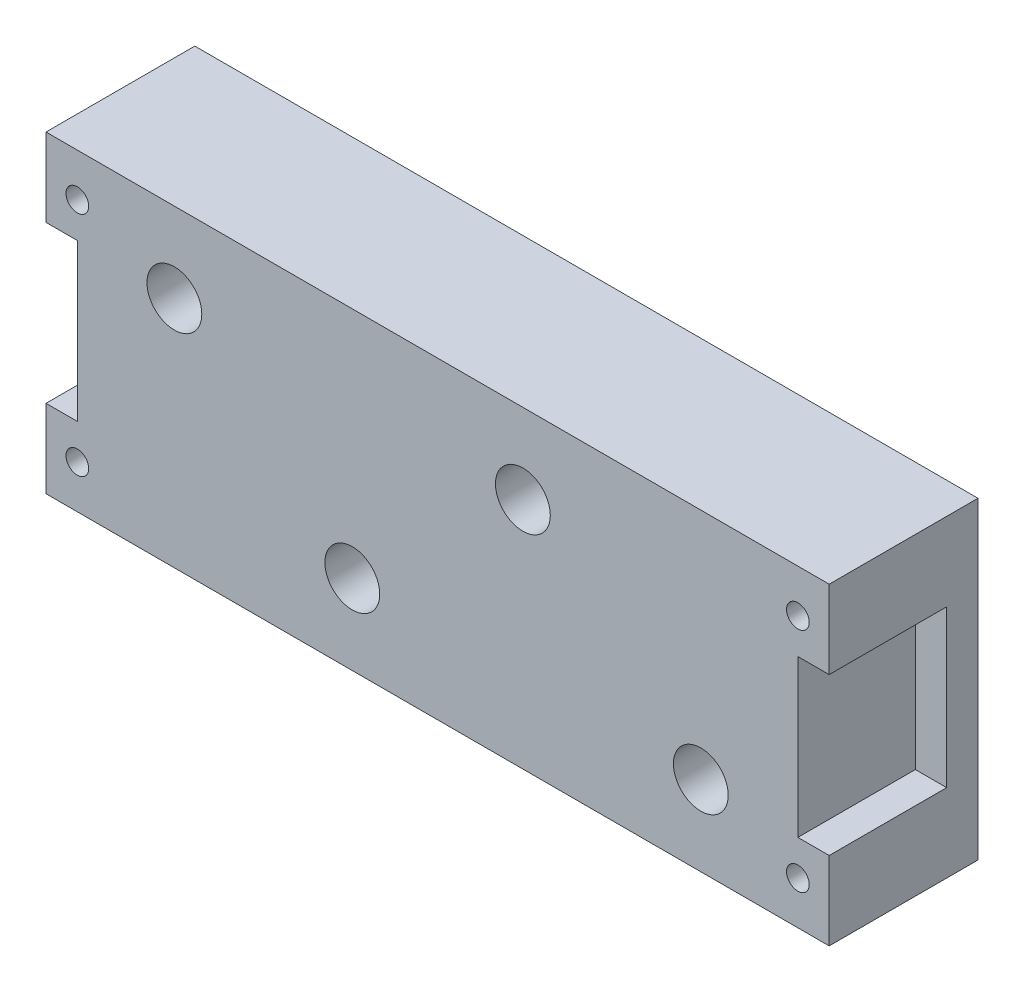
from build123d import *

# Parameters (mm, degrees)
SKETCH1_W           = 100
SKETCH1_H           = 40
BOSS_EXTRUDE1_DEPTH = 38
CUT_EXTRUDE2_START  = -12
SKETCH2_W           = 39.5
SKETCH2_H           = 34
CUT_EXTRUDE2_DEPTH  = 21
CUT_EXTRUDE3_DEPTH  = 9
CUT_EXTRUDE4_REACH  = 81.36
SKETCH4_R           = 1.45
SKETCH5_W           = 100
SKETCH5_H           = 19
CUT_EXTRUDE5_DEPTH  = 87.215210375
FILLET1_R           = 0.5
CUT_EXTRUDE11_REACH = 73.063
SKETCH10_R          = 3.5
SKETCH11_W          = 4
SKETCH11_H          = 20
CUT_EXTRUDE12_DEPTH = 15


with BuildPart() as part:
    # Sketch1 → Boss-Extrude1 (new body)
    with BuildSketch(Plane.XY):
        with Locations((16.25, 1.5625)):
            Rectangle(SKETCH1_W, SKETCH1_H)
    extrude(amount=BOSS_EXTRUDE1_DEPTH)

    # Sketch2 → Cut-Extrude2 (cut)
    with BuildSketch(Plane(origin=(0, 0, 0), x_dir=(-1, 0, 0), z_dir=(0, 0, -1)).offset(CUT_EXTRUDE2_START)):
        with Locations((-38.5, 1.5625)):
            Rectangle(SKETCH2_W, SKETCH2_H)
        with Locations((6, 1.5625)):
            Rectangle(SKETCH2_W, SKETCH2_H)
    extrude(amount=-CUT_EXTRUDE2_DEPTH, mode=Mode.SUBTRACT)

    # Sketch3 → Cut-Extrude3 (cut)
    with BuildSketch(Plane(origin=(-3.362318072, 0, 0), x_dir=(-1, 0, 0), z_dir=(0, 0, -1))):
        with BuildLine():
            ThreePointArc((-61.593370612, 1.614325749), (-20.676836723, -17.421621422), (21.715969185, -1.949710178))
            ThreePointArc((21.715969185, -1.949710178), (22.204299442, 9.465009595), (10.78957967, 9.953339852))
            ThreePointArc((10.78957967, 9.953339852), (-19.986233449, -1.278769909), (-49.690320582, 12.540715264))
            ThreePointArc((-49.690320582, 12.540715264), (-61.105040355, 13.029045522), (-61.593370612, 1.614325749))
        make_face()
    extrude(amount=-CUT_EXTRUDE3_DEPTH, mode=Mode.SUBTRACT)

    # Sketch4 → Cut-Extrude4 (cut, up to next)
    with BuildSketch(Plane(origin=(0, 0, 0), x_dir=(-1, 0, 0), z_dir=(0, 0, -1)), mode=Mode.PRIVATE) as cut_extrude4_sk1:
        with Locations((-62.25, 16.0625)):
            Circle(SKETCH4_R)
    cut_extrude4_tool1 = extrude(cut_extrude4_sk1.sketch, amount=-CUT_EXTRUDE4_REACH, mode=Mode.PRIVATE) & part.part
    # Sketch4 → Cut-Extrude4 (cut, up to next)
    with BuildSketch(Plane(origin=(0, 0, 0), x_dir=(-1, 0, 0), z_dir=(0, 0, -1)), mode=Mode.PRIVATE) as cut_extrude4_sk2:
        with Locations((-62.25, -12.9375)):
            Circle(SKETCH4_R)
    cut_extrude4_tool2 = extrude(cut_extrude4_sk2.sketch, amount=-CUT_EXTRUDE4_REACH, mode=Mode.PRIVATE) & part.part
    # Sketch4 → Cut-Extrude4 (cut, up to next)
    with BuildSketch(Plane(origin=(0, 0, 0), x_dir=(-1, 0, 0), z_dir=(0, 0, -1)), mode=Mode.PRIVATE) as cut_extrude4_sk3:
        with Locations((29.75, 16.0625)):
            Circle(SKETCH4_R)
    cut_extrude4_tool3 = extrude(cut_extrude4_sk3.sketch, amount=-CUT_EXTRUDE4_REACH, mode=Mode.PRIVATE) & part.part
    # Sketch4 → Cut-Extrude4 (cut, up to next)
    with BuildSketch(Plane(origin=(0, 0, 0), x_dir=(-1, 0, 0), z_dir=(0, 0, -1)), mode=Mode.PRIVATE) as cut_extrude4_sk4:
        with Locations((29.75, -12.9375)):
            Circle(SKETCH4_R)
    cut_extrude4_tool4 = extrude(cut_extrude4_sk4.sketch, amount=-CUT_EXTRUDE4_REACH, mode=Mode.PRIVATE) & part.part
    add(cut_extrude4_tool1.solids().sort_by_distance((62.25, 16.0625, 0))[0], mode=Mode.SUBTRACT)
    add(cut_extrude4_tool2.solids().sort_by_distance((62.25, -12.9375, 0))[0], mode=Mode.SUBTRACT)
    add(cut_extrude4_tool3.solids().sort_by_distance((-29.75, 16.0625, 0))[0], mode=Mode.SUBTRACT)
    add(cut_extrude4_tool4.solids().sort_by_distance((-29.75, -12.9375, 0))[0], mode=Mode.SUBTRACT)

    # Sketch5 → Cut-Extrude5 (cut, through all)
    with BuildSketch(Plane(origin=(0, 21.5625, 0), x_dir=(1, 0, 0), z_dir=(0, 1, 0))):
        with Locations((16.25, -9.5)):
            Rectangle(SKETCH5_W, SKETCH5_H)
    extrude(amount=-CUT_EXTRUDE5_DEPTH, mode=Mode.SUBTRACT)

    # Fillet1
    fillet1_edges = [part.edges().sort_by_distance(p)[0] for p in [
        (58.25, 18.5625, 26),
        (18.75, 18.5625, 26),
        (18.75, -15.4375, 26),
        (58.25, -15.4375, 26),
        (13.75, 18.5625, 26),
        (-25.75, 18.5625, 26),
        (-25.75, -15.4375, 26),
        (13.75, -15.4375, 26),
    ]]
    fillet(fillet1_edges, radius=FILLET1_R)

    # Sketch10 → Cut-Extrude11 (cut, up to next)
    with BuildSketch(Plane(origin=(0, 0, 33), x_dir=(-1, 0, 0), z_dir=(0, 0, -1)), mode=Mode.PRIVATE) as cut_extrude11_sk1:
        with Locations((-49.860388068, -8.232477434)):
            Circle(SKETCH10_R)
    cut_extrude11_tool1 = extrude(cut_extrude11_sk1.sketch, amount=-CUT_EXTRUDE11_REACH, mode=Mode.PRIVATE) & part.part
    # Sketch10 → Cut-Extrude11 (cut, up to next)
    with BuildSketch(Plane(origin=(0, 0, 33), x_dir=(-1, 0, 0), z_dir=(0, 0, -1)), mode=Mode.PRIVATE) as cut_extrude11_sk2:
        with Locations((-27.139611932, 11.357477434)):
            Circle(SKETCH10_R)
    cut_extrude11_tool2 = extrude(cut_extrude11_sk2.sketch, amount=-CUT_EXTRUDE11_REACH, mode=Mode.PRIVATE) & part.part
    # Sketch10 → Cut-Extrude11 (cut, up to next)
    with BuildSketch(Plane(origin=(0, 0, 33), x_dir=(-1, 0, 0), z_dir=(0, 0, -1)), mode=Mode.PRIVATE) as cut_extrude11_sk3:
        with Locations((-5.360388068, -8.232477434)):
            Circle(SKETCH10_R)
    cut_extrude11_tool3 = extrude(cut_extrude11_sk3.sketch, amount=-CUT_EXTRUDE11_REACH, mode=Mode.PRIVATE) & part.part
    # Sketch10 → Cut-Extrude11 (cut, up to next)
    with BuildSketch(Plane(origin=(0, 0, 33), x_dir=(-1, 0, 0), z_dir=(0, 0, -1)), mode=Mode.PRIVATE) as cut_extrude11_sk4:
        with Locations((17.360388068, 11.357477434)):
            Circle(SKETCH10_R)
    cut_extrude11_tool4 = extrude(cut_extrude11_sk4.sketch, amount=-CUT_EXTRUDE11_REACH, mode=Mode.PRIVATE) & part.part
    add(cut_extrude11_tool1.solids().sort_by_distance((49.860388, -8.232477, 33))[0], mode=Mode.SUBTRACT)
    add(cut_extrude11_tool2.solids().sort_by_distance((27.139612, 11.357477, 33))[0], mode=Mode.SUBTRACT)
    add(cut_extrude11_tool3.solids().sort_by_distance((5.360388, -8.232477, 33))[0], mode=Mode.SUBTRACT)
    add(cut_extrude11_tool4.solids().sort_by_distance((-17.360388, 11.357477, 33))[0], mode=Mode.SUBTRACT)

    # Sketch11 → Cut-Extrude12 (cut)
    with BuildSketch(Plane.XY.offset(38)):
        with Locations((-31.75, 1.5625)):
            Rectangle(SKETCH11_W, SKETCH11_H)
        with Locations((64.25, 1.5625)):
            Rectangle(SKETCH11_W, SKETCH11_H)
    extrude(amount=-CUT_EXTRUDE12_DEPTH, mode=Mode.SUBTRACT)


solid = part.part
